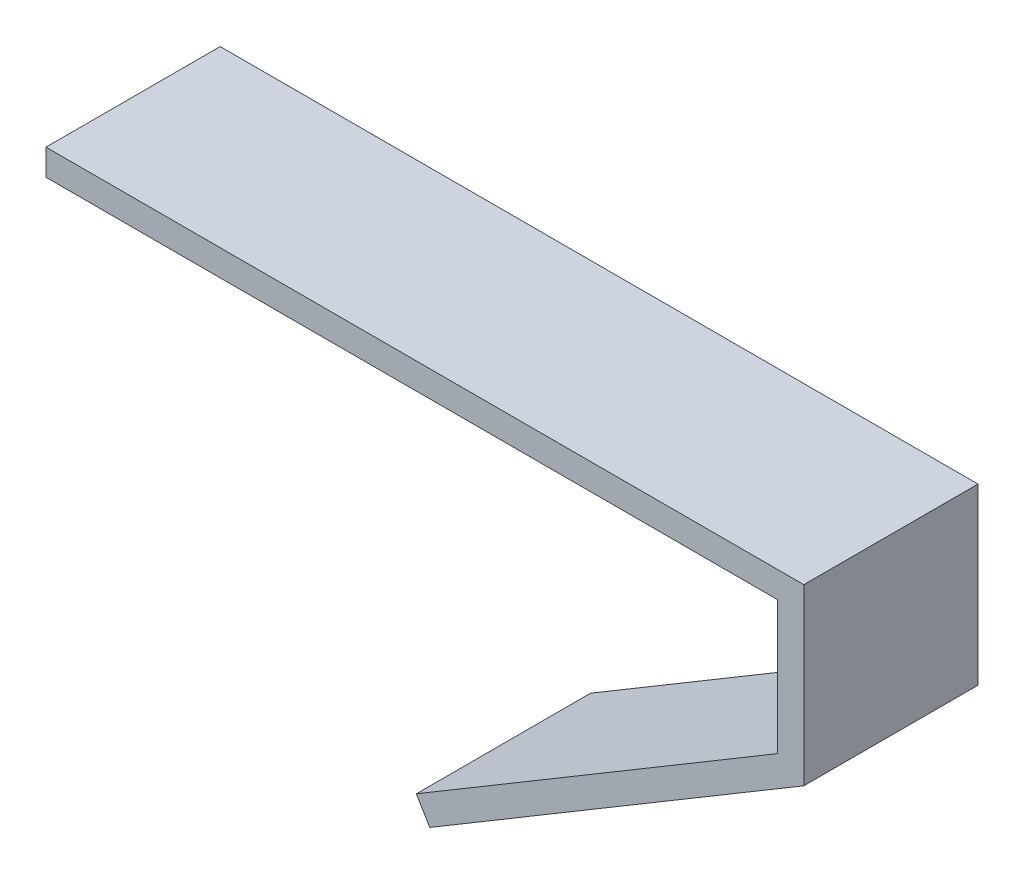
from build123d import *

# Parameters (mm, degrees)
SKETCH2_W           = 20
SKETCH2_H           = 50
BOSS_EXTRUDE1_DEPTH = 3
SKETCH3_W           = 3
SKETCH3_H           = 20
BOSS_EXTRUDE2_DEPTH = 20
SKETCH4_W           = 20
SKETCH4_H           = 3
BOSS_EXTRUDE3_DEPTH = 84


with BuildPart() as part:
    # Sketch2 → Boss-Extrude1 (new body)
    with BuildSketch(Plane(origin=(23.311118251, -39.089251492, 0), x_dir=(0, 0, 1), z_dir=(-0.5121927738543929, 0.8588705155093768, 0))):
        with Locations((18.034703764, 62.678269869)):
            Rectangle(SKETCH2_W, SKETCH2_H)
    extrude(amount=BOSS_EXTRUDE1_DEPTH)

    # Sketch3 → Boss-Extrude2 (add)
    with BuildSketch(Plane.XY.offset(28.034703764)):
        with Locations((97.115399092, 15.818924759)):
            Rectangle(SKETCH3_W, SKETCH3_H)
    extrude(amount=-BOSS_EXTRUDE2_DEPTH)

    # Sketch4 → Boss-Extrude3 (add)
    with BuildSketch(Plane.ZY.offset(-95.615399092)):
        with Locations((18.034703764, 24.318924759)):
            Rectangle(SKETCH4_W, SKETCH4_H)
    extrude(amount=BOSS_EXTRUDE3_DEPTH)


solid = part.part
